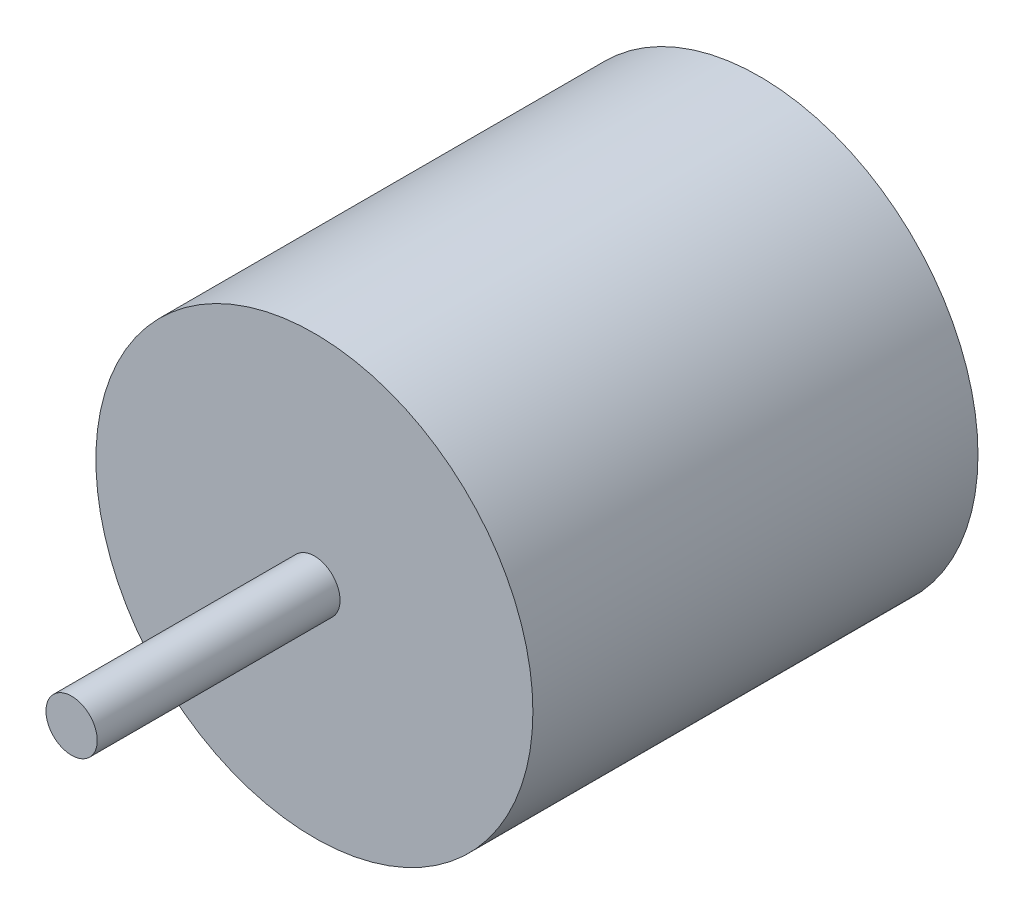
from build123d import *

# Parameters (mm, degrees)
SKETCH1_R           = 13.5
BOSS_EXTRUDE1_DEPTH = 27.5
SKETCH2_R           = 1.585
BOSS_EXTRUDE2_DEPTH = 15


with BuildPart() as part:
    # Sketch1 → Boss-Extrude1 (new body)
    with BuildSketch(Plane.XY):
        Circle(SKETCH1_R)
    extrude(amount=BOSS_EXTRUDE1_DEPTH)

    # Sketch2 → Boss-Extrude2 (add)
    with BuildSketch(Plane.XY.offset(27.5)):
        Circle(SKETCH2_R)
    extrude(amount=BOSS_EXTRUDE2_DEPTH)


solid = part.part
